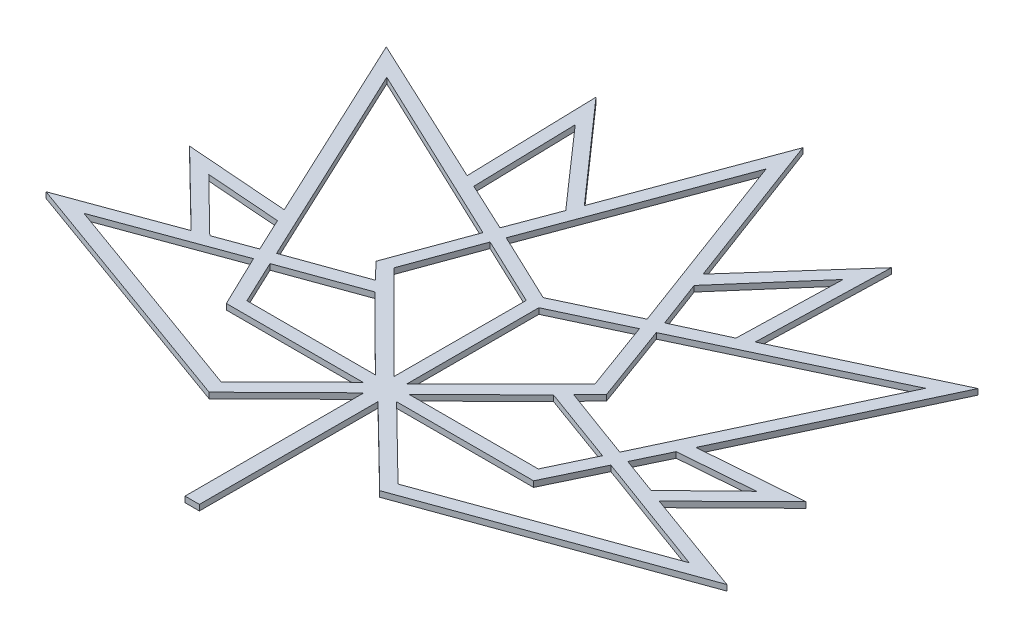
from build123d import *

# Parameters (mm, degrees)
BOSS_EXTRUDE1_DEPTH = 10


with BuildPart() as part:
    # Sketch1 → Boss-Extrude1 (new body)
    with BuildSketch(Plane(origin=(0, 0, 0), x_dir=(1, 0, 0), z_dir=(0, 1, 0))):
        Polygon((784.987851723, 398.007183844), (785.000571871, 709.000734601), (783.999038632, 709.000734601), (648.95430554, 576.00627914), (204.012861183, 736.515465829), (389.346795443, 804.38206818), (260.269155542, 930.594602451), (438.985812263, 917.017059796), (281.997531244, 1251.994529906), (546.997134557, 1127.998293592), (540.820297596, 1358.942378927), (694.484658499, 1184.98269214), (797.527155209, 1462.988304378), (901.507891553, 1184.98269214), (1055.994737963, 1359.007597162), (1049.481640439, 1127.998293592), (1313.995431768, 1251.994529906), (1156.991756683, 916.99500763), (1334.998347933, 930.999939378), (1205.935810073, 803.988718502), (1391.001934492, 736.990931112), (946.559511347, 576.00627914), (810.545996287, 709.000734601), (809.987230906, 398.007183844), align=None)
        Polygon((768.211437064, 725.031722001), (643.992624095, 601.960316667), (269.679365999, 736.990931112), (486.122884579, 816.249412651), (530.047300467, 725.031722001), align=None, mode=Mode.SUBTRACT)
        Polygon((826.995686835, 725.031722001), (952.513065316, 601.960316667), (1325.302227186, 736.990931112), (1109.467295774, 816.249412651), (1065.831329223, 725.031722001), align=None, mode=Mode.SUBTRACT)
        Polygon((826.995686835, 747.043809063), (1052.054612149, 747.043809063), (1088.054253232, 823.06470125), (953.479995281, 872.126355119), align=None, mode=Mode.SUBTRACT)
        Polygon((767.95234015, 747.043809063), (543.908716076, 747.043809063), (507.909790164, 823.302917015), (642.157906737, 871.929882397), align=None, mode=Mode.SUBTRACT)
        Polygon((476.91056803, 836.361945246), (413.154674671, 813.015460537), (319.817787826, 904.533479576), (449.560148715, 894.676634268), align=None, mode=Mode.SUBTRACT)
        Polygon((1118.830884035, 836.361945246), (1182.869407152, 813.015460537), (1276.136882601, 903.669224766), (1146.140420035, 893.441560875), align=None, mode=Mode.SUBTRACT)
        Polygon((809.005952687, 760.999981232), (973.14510679, 924.891191926), (928.399604701, 1047.084725346), (809.005952687, 991.087402872), align=None, mode=Mode.SUBTRACT)
        Polygon((786.581669339, 760.999981232), (786.995069828, 991.087402872), (667.215871678, 1047.808759575), (622.403890172, 924.891191926), align=None, mode=Mode.SUBTRACT)
        Polygon((625.071199804, 890.100070463), (596.75349244, 919.234228308), (646.861936517, 1055.688427033), (328.365599037, 1206.51214806), (498.164892008, 844.477736382), align=None, mode=Mode.SUBTRACT)
        Polygon((970.890065096, 890.100070463), (1097.709804078, 843.529573856), (1267.828250082, 1206.51214806), (948.946832949, 1055.980771306), (999.021436359, 919.234228308), align=None, mode=Mode.SUBTRACT)
        Polygon((797.527155209, 1010.09324616), (920.701437633, 1068.238980962), (797.527155209, 1398.902304133), (674.967131634, 1068.238980962), align=None, mode=Mode.SUBTRACT)
        Polygon((654.433985107, 1077.890698346), (685.66424413, 1161.312305797), (564.365750317, 1299.115972687), (568.857249407, 1117.806751608), align=None, mode=Mode.SUBTRACT)
        Polygon((941.613316466, 1077.890698346), (1026.742088945, 1116.968977072), (1031.676560348, 1299.115972687), (910.781362362, 1160.123449622), align=None, mode=Mode.SUBTRACT)
    extrude(amount=BOSS_EXTRUDE1_DEPTH)


solid = part.part
